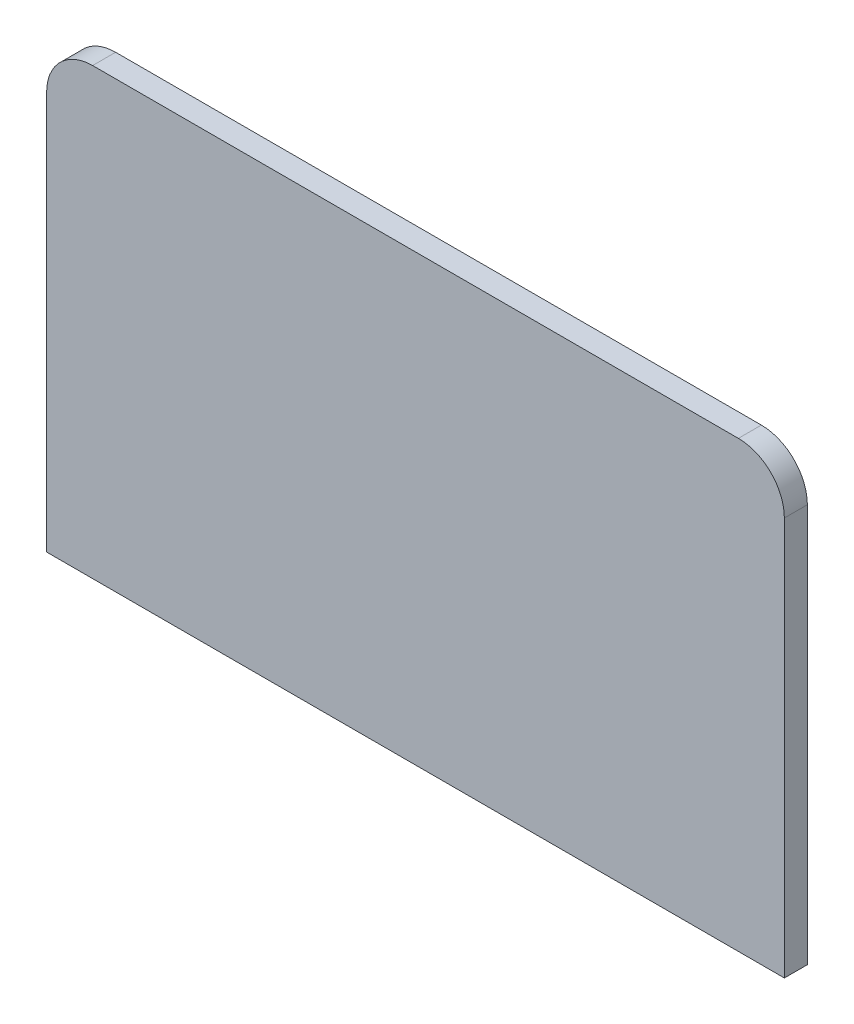
from build123d import *

# Parameters (mm, degrees)
SKETCH1_W           = 203.708
SKETCH1_H           = 122.699748668
BOSS_EXTRUDE1_DEPTH = 6.35
FILLET1_R           = 12.7


with BuildPart() as part:
    # Sketch1 → Boss-Extrude1 (new body)
    with BuildSketch(Plane.XY):
        with Locations((-81.646636302, 1465.959878685)):
            Rectangle(SKETCH1_W, SKETCH1_H)
    extrude(amount=BOSS_EXTRUDE1_DEPTH)

    # Fillet1
    fillet1_edges = [part.edges().sort_by_distance(p)[0] for p in [
        (-183.500636302, 1527.309753019, 3.175),
        (20.207363698, 1527.309753019, 3.175),
    ]]
    fillet(fillet1_edges, radius=FILLET1_R)


solid = part.part
